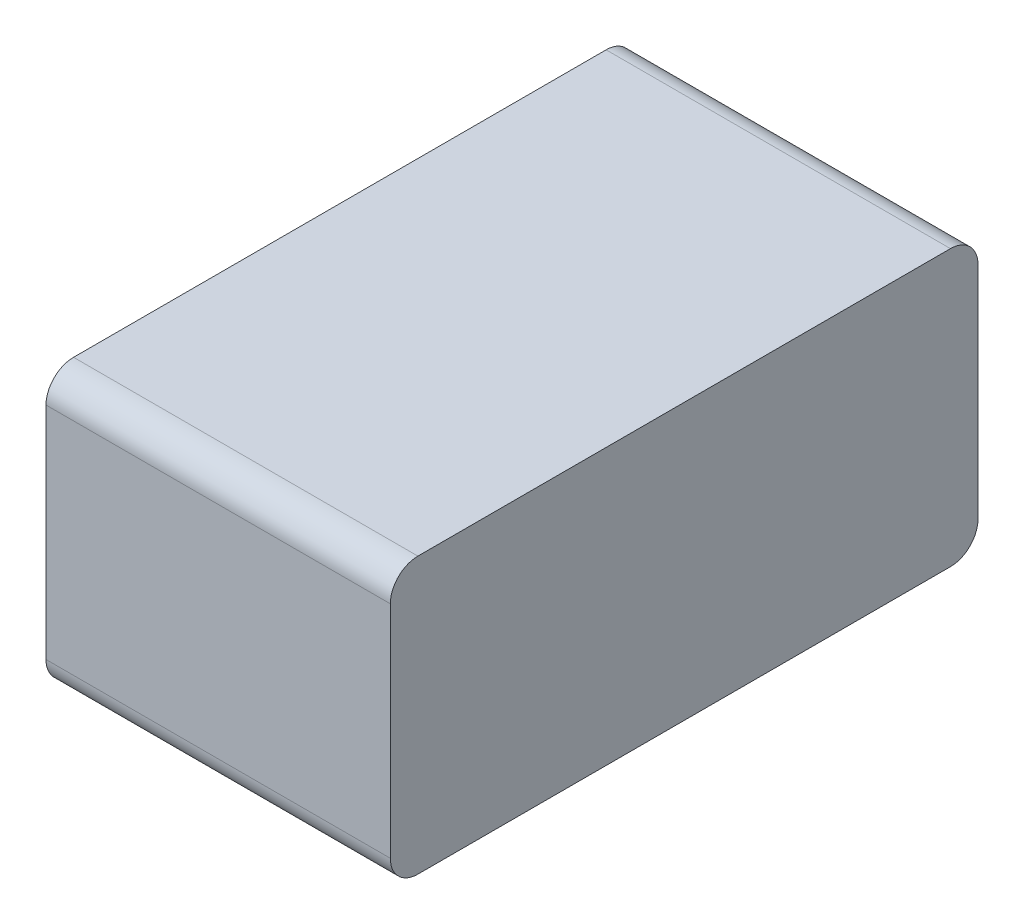
from build123d import *

# Parameters (mm, degrees)
SKETCH1_W       = 30
SKETCH1_H       = 64
BLOCK_DEPTH     = 37.5
BLOCKFILLET_R   = 3
SKETCH2_R       = 5.5
JACKHOLES_DEPTH = 36.5


with BuildPart() as part:
    # Sketch1 → Block (new body)
    with BuildSketch(Plane.YZ):
        Rectangle(SKETCH1_W, SKETCH1_H)
    extrude(amount=BLOCK_DEPTH)

    # BlockFillet
    blockfillet_edges = [part.edges().sort_by_distance(p)[0] for p in [
        (18.75, -15, 32),
        (18.75, 15, 32),
        (18.75, 15, -32),
        (18.75, -15, -32),
    ]]
    fillet(blockfillet_edges, radius=BLOCKFILLET_R)

    # Sketch2 → JackHoles (cut)
    with BuildSketch(Plane(origin=(0, 0, 0), x_dir=(0, -1, 0), z_dir=(-1, 0, 0))):
        with Locations(Location((-3, -20, 0), (0, 0, 90))):
            Circle(SKETCH2_R)
        with Locations(Location((-3, 0, 0), (0, 0, 90))):
            Circle(SKETCH2_R)
        with Locations(Location((-3, 20, 0), (0, 0, 90))):
            Circle(SKETCH2_R)
    extrude(amount=-JACKHOLES_DEPTH, mode=Mode.SUBTRACT)


solid = part.part
